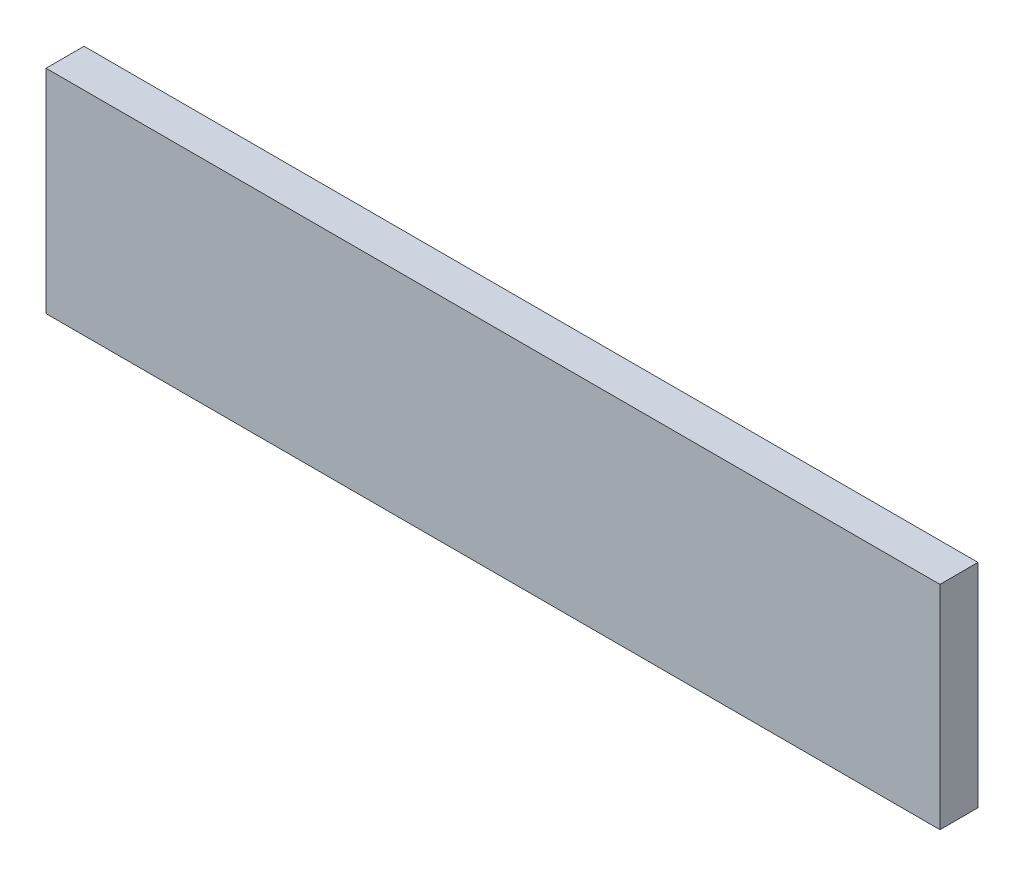
from build123d import *

# Parameters (mm, degrees)
SKETCH1_W           = 234.980708934
SKETCH1_H           = 55.852422294
BOSS_EXTRUDE1_DEPTH = 10


with BuildPart() as part:
    # Sketch1 → Boss-Extrude1 (new body)
    with BuildSketch(Plane.XY):
        Rectangle(SKETCH1_W, SKETCH1_H)
    extrude(amount=BOSS_EXTRUDE1_DEPTH)


solid = part.part
